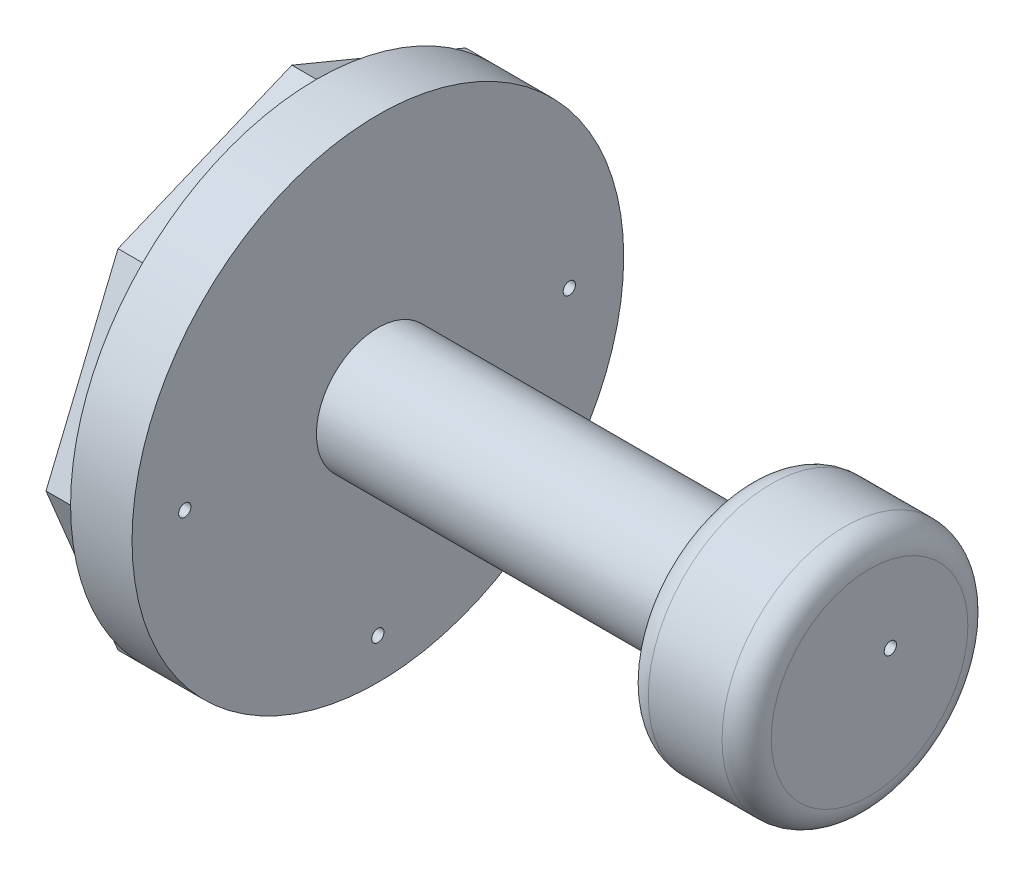
from build123d import *

# Parameters (mm, degrees)
FILLET7_R             = 2
FILLET8_R             = 2
SKETCH2_R             = 17.932362589
SKETCH2_R_2           = 4.070139316
SKETCH2_R_3           = 1.470244109
BOSS_EXTRUDE4_DEPTH   = 2
F_1_0MM_DOWEL_HOLE1_D = 1
F_1_0MM_DOWEL_HOLE3_D = 1


with BuildPart() as part:
    # Sketch1 → Revolve2 (revolve)
    with BuildSketch(Plane.XY, mode=Mode.PRIVATE) as revolve2_sk:
        Polygon((-22.5, 0), (22.5, 0), (22.5, 5), (22.5, 10), (12.5, 10), (12.5, 5), (-17.5, 5), (-17.5, 20), (-22.5, 20), align=None)
    revolve(revolve2_sk.sketch.rotate(Axis((-22.5, 0, 0), (1, 0, 0)), 90), axis=Axis((-22.5, 0, 0), (1, 0, 0)))

    # Fillet7
    fillet7_edges = [part.edges().sort_by_distance(p)[0] for p in [
        (22.5, 0, -10),
    ]]
    fillet(fillet7_edges, radius=FILLET7_R)

    # Fillet8
    fillet8_edges = [part.edges().sort_by_distance(p)[0] for p in [
        (12.5, 0, -10),
    ]]
    fillet(fillet8_edges, radius=FILLET8_R)

    # Sketch2 → Boss-Extrude4 (add)
    # profile 1 of 7: a face of its own
    with BuildSketch(Plane.ZY.offset(22.5)):
        Polygon((0, 20), (-14.142135624, 14.142135624), (-20, 0), (-14.142135624, -14.142135624), (0, -20), (14.142135624, -14.142135624), (20, 0), (14.142135624, 14.142135624), align=None)
        Circle(SKETCH2_R, mode=Mode.SUBTRACT)
    # profile 2 of 7: a face of its own
    with BuildSketch(Plane.ZY.offset(22.5)):
        with Locations((7.5, 6.359605711)):
            Circle(SKETCH2_R_2)
        with Locations((7.5, 6.359605711)):
            Circle(SKETCH2_R_3, mode=Mode.SUBTRACT)
    # profile 3 of 7: a face of its own
    with BuildSketch(Plane.ZY.offset(22.5)):
        with Locations((-7.5, 6.816829323)):
            Circle(SKETCH2_R_2)
        with Locations((-7.5, 6.816829323)):
            Circle(SKETCH2_R_3, mode=Mode.SUBTRACT)
    # profile 4 of 7: a face of its own
    with BuildSketch(Plane.ZY.offset(22.5)):
        Polygon((-5.383481764, 14.709120363), (-1.33333, 10.377946656), (-3.850746579, 9.493506516), (-6.434561549, 12.256600867), align=None)
    # profile 5 of 7: a face of its own
    with BuildSketch(Plane.ZY.offset(22.5)):
        with BuildLine():
            Line((-11.570139316, -4.68431352), (11.757283774, -4.68431352))
            add(Edge.make_bspline(
                [(-11.570139316, -4.68431352), (0.019330621, -23.600400847), (11.757283774, -4.68431352)],
                knots=[0, 0, 0, 1, 1, 1], degree=2))
        make_face()
        with BuildLine():
            Line((-7.5, -6.493557604), (7.5, -6.493557604))
            add(Edge.make_bspline(
                [(7.5, -6.493557604), (0, -19.67127169), (-7.5, -6.493557604)],
                knots=[0, 0, 0, 1, 1, 1], degree=2))
        make_face(mode=Mode.SUBTRACT)
    # profile 6 of 7: a face of its own
    with BuildSketch(Plane.ZY.offset(22.5)):
        Polygon((5.664503708, 14.42809842), (1.33333, 10.377946656), (3.785849496, 9.326866872), (6.548943848, 11.910681841), align=None)
    # profile 7 of 7: a face of its own
    with BuildSketch(Plane.ZY.offset(22.5)):
        Polygon((-0.404292244, 2.684485233), (2.559752906, -0.834695524), (-2.116560108, -1.19469663), align=None)
    extrude(amount=BOSS_EXTRUDE4_DEPTH)

    # Ø1.0mm Dowel Hole1 (through all)
    with Locations(Plane(origin=(22.5, 0, 0), x_dir=(0, 0, -1), z_dir=(1, 0, 0))):
        with Locations((1.693680894, 1.577447892)):
            Hole(F_1_0MM_DOWEL_HOLE1_D / 2)

    # Ø1.0mm Dowel Hole3 (through all)
    with Locations(Plane.ZY.offset(22.5)):
        with Locations((15.708060058, 0), (-15.575222341, 0), (0, -16.687738223)):
            Hole(F_1_0MM_DOWEL_HOLE3_D / 2)


solid = part.part
